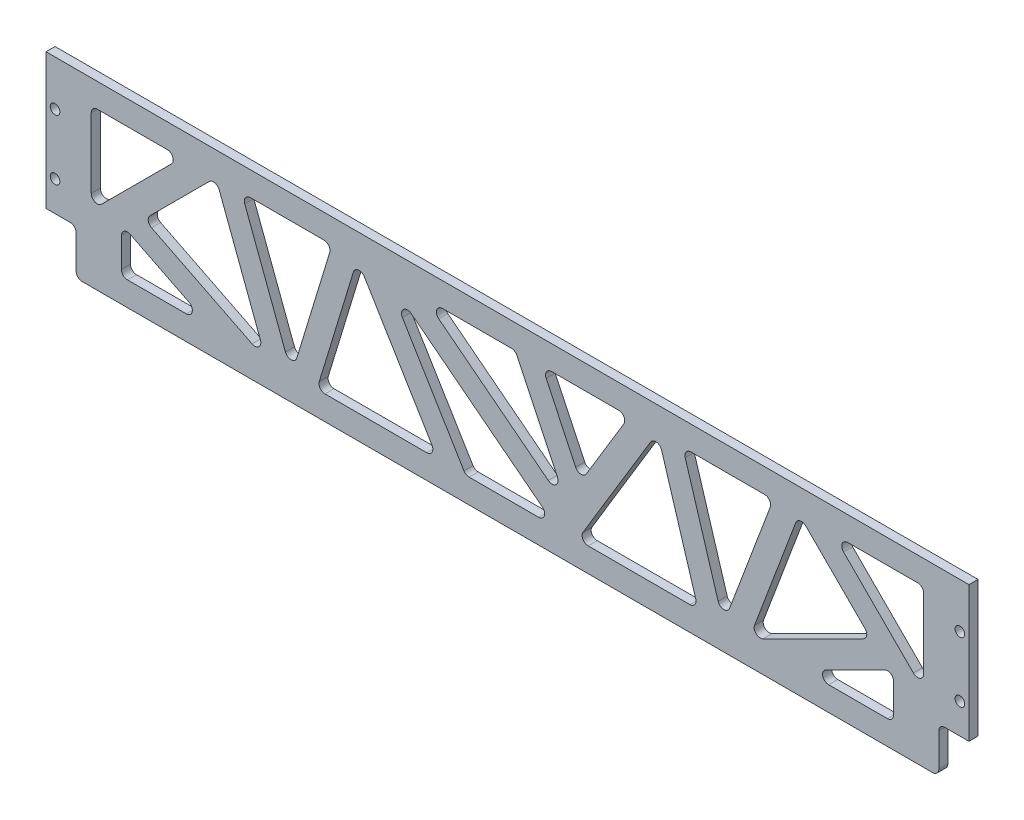
from build123d import *

# Parameters (mm, degrees)
SKETCH_1_W              = 306
SKETCH_1_H              = 60
EXTRUDE_1_DEPTH         = 3
HOLE_WIZARD_3_2_3_2_1_D = 3.2
SKETCH_4_W              = 10
SKETCH_4_H              = 15
CUT_EXTRUDE_1_DEPTH     = 156.94229702
FILLET_1_R              = 2
FILLET_2_R              = 2


with BuildPart() as part:
    # 草图1 → 凸台-拉伸1 (new body)
    with BuildSketch(Plane.XY):
        Rectangle(SKETCH_1_W, SKETCH_1_H)
    extrude(amount=EXTRUDE_1_DEPTH)

    # Ø3.2 (3.2) 直径孔1 (through all)
    with Locations(Plane(origin=(-150, 15, 3), x_dir=(1, 0, 0), z_dir=(0, 0, 1))):
        with Locations((0, 0), (0, -20), (300, 0), (300, -20)):
            Hole(HOLE_WIZARD_3_2_3_2_1_D / 2)

    # 草图4 → 切除-拉伸1 (cut, through all)
    with BuildSketch(Plane.XY.offset(3)):
        Polygon((-138, 22), (-138, -8), (-108, 22), align=None)
        with Locations((-148, -22.5)):
            Rectangle(SKETCH_4_W, SKETCH_4_H)
        Polygon((-128, -7), (-128, -22), (-98, -22), align=None)
        Polygon((-120.494679727, -1.808388226), (-80.11145618, -22), (-96.686291501, 22), align=None)
        Polygon((-88.137500729, 22), (-58.137500729, 22), (-71.562665408, -22), align=None)
        Polygon((-49.773399859, 22), (-63.198564538, -22), (-23.198564538, -22), align=None)
        Polygon((23.198564538, -22), (49.773399859, 22), (63.198564538, -22), align=None)
        Polygon((71.562665408, -22), (88.137500729, 22), (58.137500729, 22), align=None)
        Polygon((96.686291501, 22), (120.494679727, -1.808388226), (80.11145618, -22), align=None)
        Polygon((98, -22), (128, -7), (128, -22), align=None)
        Polygon((108, 22), (138, 22), (138, -8), align=None)
        with Locations((148, -22.5)):
            Rectangle(SKETCH_4_W, SKETCH_4_H)
        Polygon((-40.427482162, 22), (-13.852646841, -22), (16.147353159, -22), align=None)
        Polygon((-27.396416938, 22), (20.1778764, -15), (2.603583062, 22), align=None)
        Polygon((11.460153437, 22), (24.21224704, -4.847592346), (40.427482162, 22), align=None)
    extrude(amount=-CUT_EXTRUDE_1_DEPTH, mode=Mode.SUBTRACT)

    # 圆角1
    fillet_1_edges = [part.edges().sort_by_distance(p)[0] for p in [
        (128, -22, 1.5),
        (98, -22, 1.5),
        (128, -7, 1.5),
        (138, -8, 1.5),
        (108, 22, 1.5),
        (138, 22, 1.5),
        (11.460153437, 22, 1.5),
        (40.427482162, 22, 1.5),
        (24.21224704, -4.847592346, 1.5),
        (-27.396416938, 22, 1.5),
        (2.603583062, 22, 1.5),
        (20.1778764, -15, 1.5),
        (-120.494679727, -1.808388226, 1.5),
        (-96.686291501, 22, 1.5),
        (-80.11145618, -22, 1.5),
        (-71.562665408, -22, 1.5),
        (-88.137500729, 22, 1.5),
        (-58.137500729, 22, 1.5),
        (-138, 22, 1.5),
        (-108, 22, 1.5),
        (-138, -8, 1.5),
        (-128, -7, 1.5),
        (-98, -22, 1.5),
        (-128, -22, 1.5),
        (71.562665408, -22, 1.5),
        (58.137500729, 22, 1.5),
        (88.137500729, 22, 1.5),
        (80.11145618, -22, 1.5),
        (96.686291501, 22, 1.5),
        (120.494679727, -1.808388226, 1.5),
        (63.198564538, -22, 1.5),
        (23.198564538, -22, 1.5),
        (49.773399859, 22, 1.5),
        (-49.773399859, 22, 1.5),
        (-23.198564538, -22, 1.5),
        (-63.198564538, -22, 1.5),
        (-40.427482162, 22, 1.5),
        (16.147353159, -22, 1.5),
        (-13.852646841, -22, 1.5),
    ]]
    fillet(fillet_1_edges, radius=FILLET_1_R)

    # 圆角2
    fillet_2_edges = [part.edges().sort_by_distance(p)[0] for p in [
        (-143, -15, 1.5),
        (-143, -30, 1.5),
        (143, -30, 1.5),
        (143, -15, 1.5),
    ]]
    fillet(fillet_2_edges, radius=FILLET_2_R)


solid = part.part
